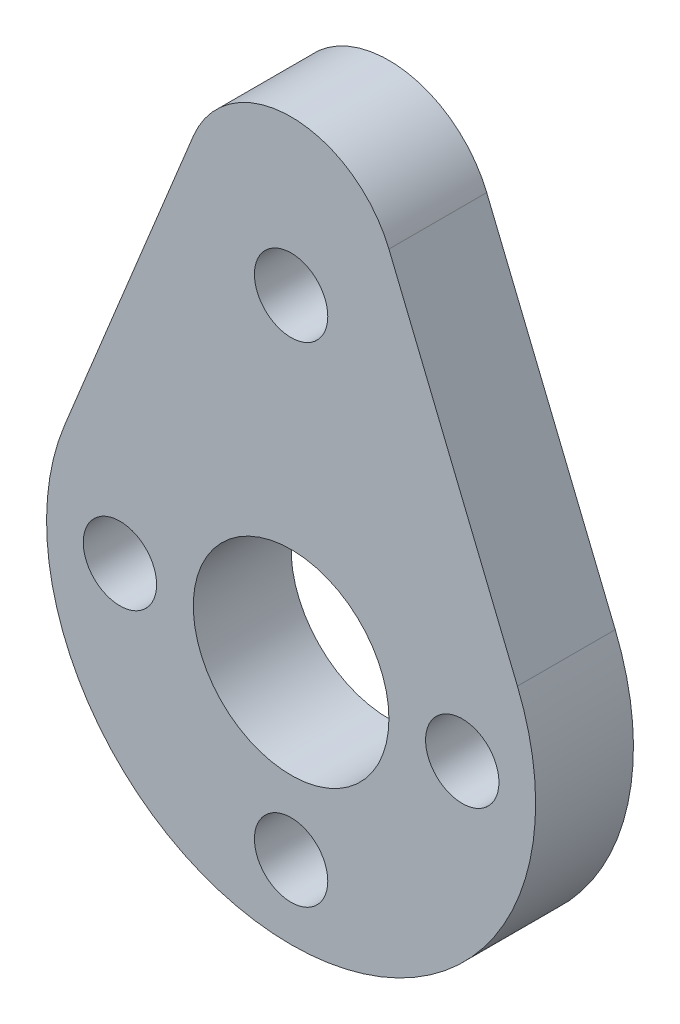
from build123d import *

# Parameters (mm, degrees)
SKETCH_1_R      = 1.5
SKETCH_1_R_2    = 4
EXTRUDE_1_DEPTH = 4


with BuildPart() as part:
    # 草图1 → 凸台-拉伸1 (new body)
    with BuildSketch(Plane.XY):
        with BuildLine():
            Line((-4, 16.63598728), (-9.255774721, 3.785582428))
            ThreePointArc((-9.255774721, 3.785582428), (0, -10), (9.255774721, 3.785582428))
            Line((9.255774721, 3.785582428), (4, 16.63598728))
            ThreePointArc((4, 16.63598728), (0, 19.321626358), (-4, 16.63598728))
        make_face()
        with Locations((-7, 0)):
            Circle(SKETCH_1_R, mode=Mode.SUBTRACT)
        with Locations((7, 0)):
            Circle(SKETCH_1_R, mode=Mode.SUBTRACT)
        with Locations((0, -7)):
            Circle(SKETCH_1_R, mode=Mode.SUBTRACT)
        with Locations((0, 13)):
            Circle(SKETCH_1_R, mode=Mode.SUBTRACT)
        Circle(SKETCH_1_R_2, mode=Mode.SUBTRACT)
    extrude(amount=EXTRUDE_1_DEPTH)


solid = part.part
